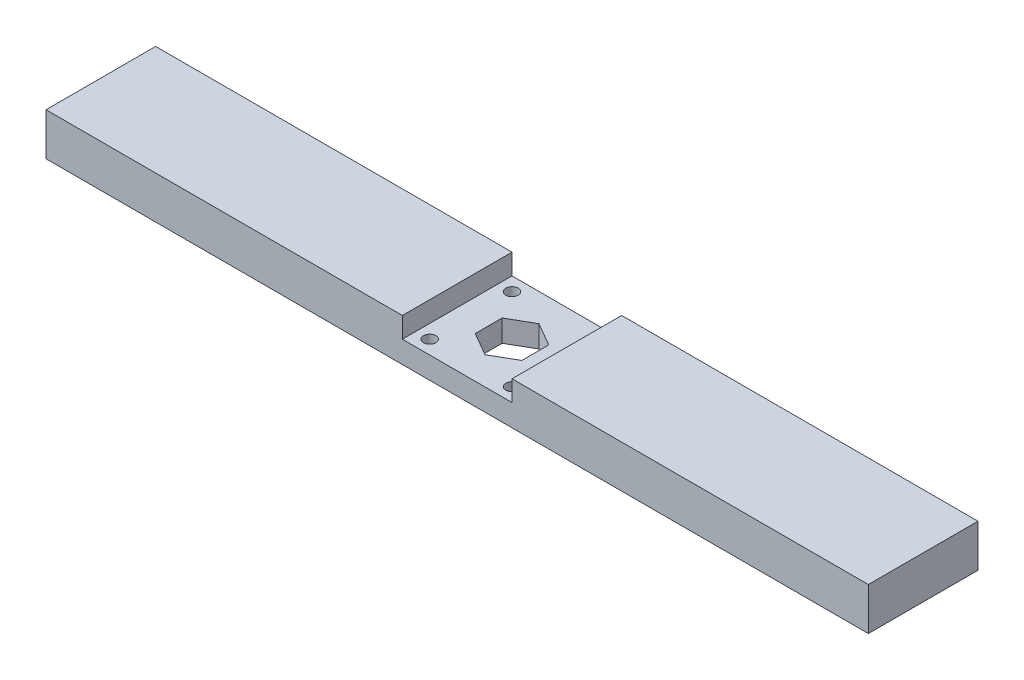
from build123d import *

# Parameters (mm, degrees)
BOSS_EXTRUDE1_DEPTH = 20
SKETCH2_R           = 2.25
CUT_EXTRUDE1_DEPTH  = 40


with BuildPart() as part:
    # Sketch1 → Boss-Extrude1 (new, symmetric)
    with BuildSketch(Plane.XY):
        Polygon((-150, 7.75), (-150, -7.75), (150, -7.75), (150, 7.75), (20, 7.75), (20, 0.25), (-20, 0.25), (-20, 7.75), align=None)
    extrude(amount=BOSS_EXTRUDE1_DEPTH, both=True)

    # Sketch2 → Cut-Extrude1 (cut)
    with BuildSketch(Plane(origin=(0, 0.25, 0), x_dir=(1, 0, 0), z_dir=(0, 1, 0))):
        with Locations(Location((15.015, 15, 0), (0, 0, 270))):
            Circle(SKETCH2_R)
        with Locations(Location((-15.015, 15, 0), (0, 0, 180))):
            Circle(SKETCH2_R)
        with Locations(Location((15.015, -15, 0), (0, 0, 180))):
            Circle(SKETCH2_R)
        with Locations(Location((-15.015, -15, 0), (0, 0, 270))):
            Circle(SKETCH2_R)
        Polygon((0, -9.814954576), (8.5, -4.907477288), (8.5, 4.907477288), (0, 9.814954576), (-8.5, 4.907477288), (-8.5, -4.907477288), align=None)
    extrude(amount=-CUT_EXTRUDE1_DEPTH, mode=Mode.SUBTRACT)


solid = part.part
